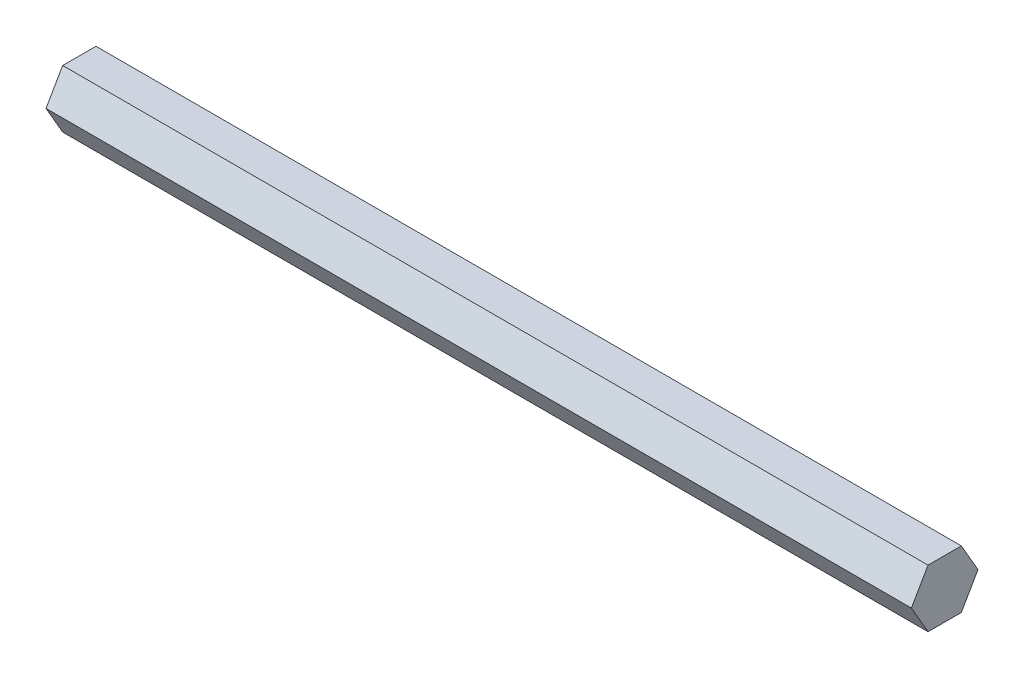
from build123d import *

# Parameters (mm, degrees)
BOSS_EXTRUDE1_DEPTH = 190.5


with BuildPart() as part:
    # Sketch1 → Boss-Extrude1 (new body)
    with BuildSketch(Plane(origin=(0, 0, 0), x_dir=(0, -1, 0), z_dir=(-1, 0, 0))):
        Polygon((-6.35, 3.666174209), (-6.35, -3.666174209), (0, -7.332348419), (6.35, -3.666174209), (6.35, 3.666174209), (0, 7.332348419), align=None)
    extrude(amount=-BOSS_EXTRUDE1_DEPTH)


solid = part.part
